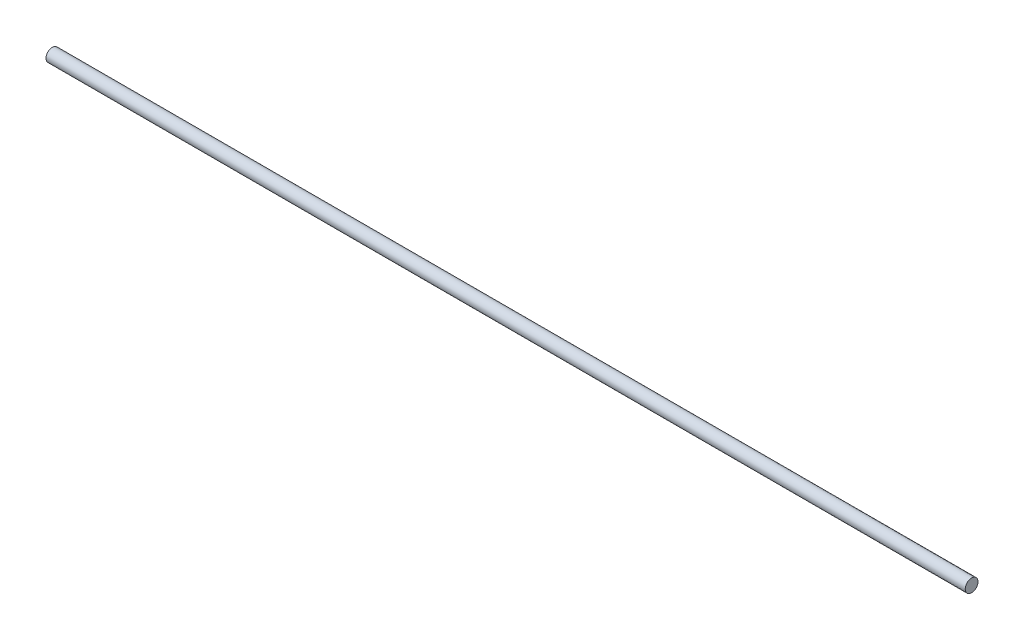
from build123d import *

# Parameters (mm, degrees)
SKETCH1_R           = 6.35
BOSS_EXTRUDE1_DEPTH = 457.2


with BuildPart() as part:
    # Sketch1 → Boss-Extrude1 (new, symmetric)
    with BuildSketch(Plane(origin=(0, 0, 0), x_dir=(0, 0, -1), z_dir=(1, 0, 0))):
        Circle(SKETCH1_R)
    extrude(amount=BOSS_EXTRUDE1_DEPTH, both=True)


solid = part.part
